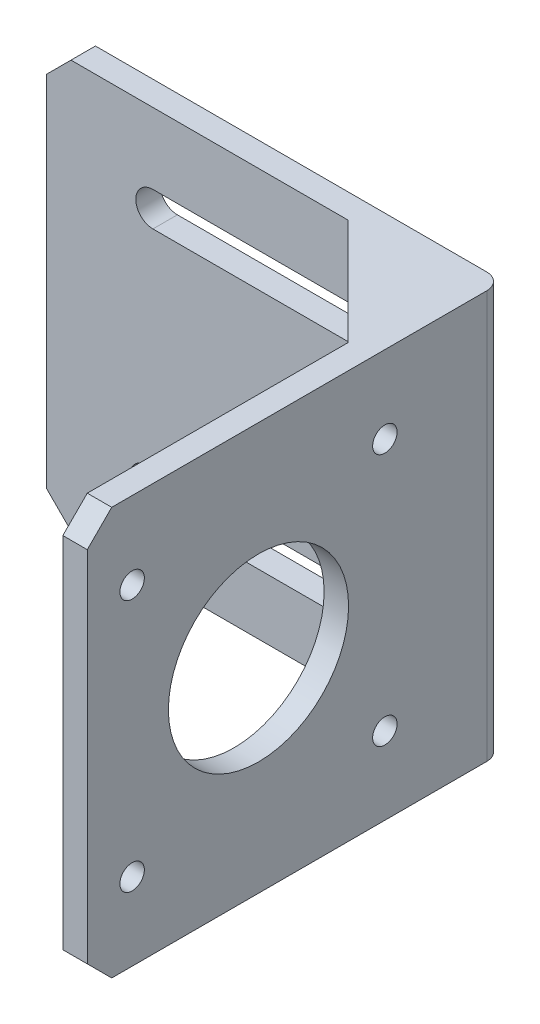
from build123d import *

# Parameters (mm, degrees)
SZKIC5_W                    = 53
SZKIC5_H                    = 50
DODANIE_WYCI_GNI_CIE2_DEPTH = 3
SZKIC6_W                    = 3
SZKIC6_H                    = 50
DODANIE_WYCI_GNI_CIE3_DEPTH = 48
ZAOKR_GLENIE1_R             = 2
SFAZOWANIE2_SIZE            = 3
SFAZOWANIE4_SIZE            = 3
WYTNIJ_WYCI_GNI_CIE2_REACH  = 79.685
SZKIC7_R                    = 11.05
WYTNIJ_WYCI_GNI_CIE3_REACH  = 79.685
SZKIC9_R                    = 1.5
WYTNIJ_WYCI_GNI_CIE4_REACH  = 79.685
SZKIC10_R                   = 1.5
WYTNIJ_WYCI_GNI_CIE5_REACH  = 79.685
SZKIC11_R                   = 1.5
WYTNIJ_WYCI_GNI_CIE6_REACH  = 79.685
SZKIC12_R                   = 1.5
DODANIE_WYCI_GNI_CIE4_DEPTH = 3
DODANIE_WYCI_GNI_CIE5_DEPTH = 3
WYTNIJ_WYCI_GNI_CIE7_DEPTH  = 3


with BuildPart() as part:
    # Szkic5 → Dodanie-wyciągnięcie2 (new body)
    with BuildSketch(Plane.XY):
        Rectangle(SZKIC5_W, SZKIC5_H)
    extrude(amount=DODANIE_WYCI_GNI_CIE2_DEPTH)

    # Szkic6 → Dodanie-wyciągnięcie3 (add)
    with BuildSketch(Plane.XY.offset(3)):
        with Locations((25, 0)):
            Rectangle(SZKIC6_W, SZKIC6_H)
    extrude(amount=DODANIE_WYCI_GNI_CIE3_DEPTH)

    # Zaokrąglenie1
    zaokr_glenie1_edges = [part.edges().sort_by_distance(p)[0] for p in [
        (26.5, 0, 0),
    ]]
    fillet(zaokr_glenie1_edges, radius=ZAOKR_GLENIE1_R)

    # Sfazowanie2
    sfazowanie2_edges = [part.edges().sort_by_distance(p)[0] for p in [
        (25, -25, 51),
        (-26.5, -25, 1.5),
        (-26.5, 25, 1.5),
    ]]
    chamfer(sfazowanie2_edges, length=SFAZOWANIE2_SIZE)

    # Sfazowanie4
    sfazowanie4_edges = [part.edges().sort_by_distance(p)[0] for p in [
        (25, 25, 51),
    ]]
    chamfer(sfazowanie4_edges, length=SFAZOWANIE4_SIZE)

    # Szkic7 → Wytnij-wyciągnięcie2 (cut, up to next)
    with BuildSketch(Plane(origin=(26.5, 0, 0), x_dir=(0, 0, -1), z_dir=(1, 0, 0)), mode=Mode.PRIVATE) as wytnij_wyci_gni_cie2_sk1:
        with Locations((-30, 0)):
            Circle(SZKIC7_R)
    wytnij_wyci_gni_cie2_tool1 = extrude(wytnij_wyci_gni_cie2_sk1.sketch, amount=-WYTNIJ_WYCI_GNI_CIE2_REACH, mode=Mode.PRIVATE) & part.part
    add(wytnij_wyci_gni_cie2_tool1.solids().sort_by_distance((26.5, 0, 30))[0], mode=Mode.SUBTRACT)

    # Szkic9 → Wytnij-wyciągnięcie3 (cut, up to next)
    with BuildSketch(Plane(origin=(26.5, 0, 0), x_dir=(0, 0, -1), z_dir=(1, 0, 0)), mode=Mode.PRIVATE) as wytnij_wyci_gni_cie3_sk1:
        with Locations((-45.5, 15.5)):
            Circle(SZKIC9_R)
    wytnij_wyci_gni_cie3_tool1 = extrude(wytnij_wyci_gni_cie3_sk1.sketch, amount=-WYTNIJ_WYCI_GNI_CIE3_REACH, mode=Mode.PRIVATE) & part.part
    add(wytnij_wyci_gni_cie3_tool1.solids().sort_by_distance((26.5, 15.5, 45.5))[0], mode=Mode.SUBTRACT)

    # Szkic10 → Wytnij-wyciągnięcie4 (cut, up to next)
    with BuildSketch(Plane(origin=(26.5, 0, 0), x_dir=(0, 0, -1), z_dir=(1, 0, 0)), mode=Mode.PRIVATE) as wytnij_wyci_gni_cie4_sk1:
        with Locations((-45.5, -15.5)):
            Circle(SZKIC10_R)
    wytnij_wyci_gni_cie4_tool1 = extrude(wytnij_wyci_gni_cie4_sk1.sketch, amount=-WYTNIJ_WYCI_GNI_CIE4_REACH, mode=Mode.PRIVATE) & part.part
    add(wytnij_wyci_gni_cie4_tool1.solids().sort_by_distance((26.5, -15.5, 45.5))[0], mode=Mode.SUBTRACT)

    # Szkic11 → Wytnij-wyciągnięcie5 (cut, up to next)
    with BuildSketch(Plane(origin=(26.5, 0, 0), x_dir=(0, 0, -1), z_dir=(1, 0, 0)), mode=Mode.PRIVATE) as wytnij_wyci_gni_cie5_sk1:
        with Locations((-14.5, -15.5)):
            Circle(SZKIC11_R)
    wytnij_wyci_gni_cie5_tool1 = extrude(wytnij_wyci_gni_cie5_sk1.sketch, amount=-WYTNIJ_WYCI_GNI_CIE5_REACH, mode=Mode.PRIVATE) & part.part
    add(wytnij_wyci_gni_cie5_tool1.solids().sort_by_distance((26.5, -15.5, 14.5))[0], mode=Mode.SUBTRACT)

    # Szkic12 → Wytnij-wyciągnięcie6 (cut, up to next)
    with BuildSketch(Plane(origin=(26.5, 0, 0), x_dir=(0, 0, -1), z_dir=(1, 0, 0)), mode=Mode.PRIVATE) as wytnij_wyci_gni_cie6_sk1:
        with Locations((-14.5, 15.5)):
            Circle(SZKIC12_R)
    wytnij_wyci_gni_cie6_tool1 = extrude(wytnij_wyci_gni_cie6_sk1.sketch, amount=-WYTNIJ_WYCI_GNI_CIE6_REACH, mode=Mode.PRIVATE) & part.part
    add(wytnij_wyci_gni_cie6_tool1.solids().sort_by_distance((26.5, 15.5, 14.5))[0], mode=Mode.SUBTRACT)

    # Szkic15 → Dodanie-wyciągnięcie4 (add)
    with BuildSketch(Plane(origin=(0, 25, 0), x_dir=(1, 0, 0), z_dir=(0, 1, 0))):
        Polygon((23.5, -16), (10.5, -3), (23.5, -3), align=None)
    extrude(amount=-DODANIE_WYCI_GNI_CIE4_DEPTH)

    # Szkic16 → Dodanie-wyciągnięcie5 (add)
    with BuildSketch(Plane.XZ.offset(25)):
        Polygon((23.5, 3), (23.5, 16), (10.5, 3), align=None)
    extrude(amount=-DODANIE_WYCI_GNI_CIE5_DEPTH)

    # Szkic17 → Wytnij-wyciągnięcie7 (cut)
    with BuildSketch(Plane.XY.offset(3)):
        with BuildLine():
            Line((16.551792378, 12.093759381), (-13.448207622, 12.093759381))
            ThreePointArc((-13.448207622, 12.093759381), (-15.548207622, 14.193759381), (-13.448207622, 16.293759381))
            Line((-13.448207622, 16.293759381), (16.551792378, 16.293759381))
            ThreePointArc((16.551792378, 16.293759381), (18.651792378, 14.193759381), (16.551792378, 12.093759381))
        make_face()
        with BuildLine():
            Line((15.82894882, -17.577234295), (-14.17105118, -17.577234295))
            ThreePointArc((-14.17105118, -17.577234295), (-16.27105118, -15.477234295), (-14.17105118, -13.377234295))
            Line((-14.17105118, -13.377234295), (15.82894882, -13.377234295))
            ThreePointArc((15.82894882, -13.377234295), (17.92894882, -15.477234295), (15.82894882, -17.577234295))
        make_face()
    extrude(amount=-WYTNIJ_WYCI_GNI_CIE7_DEPTH, mode=Mode.SUBTRACT)


solid = part.part
